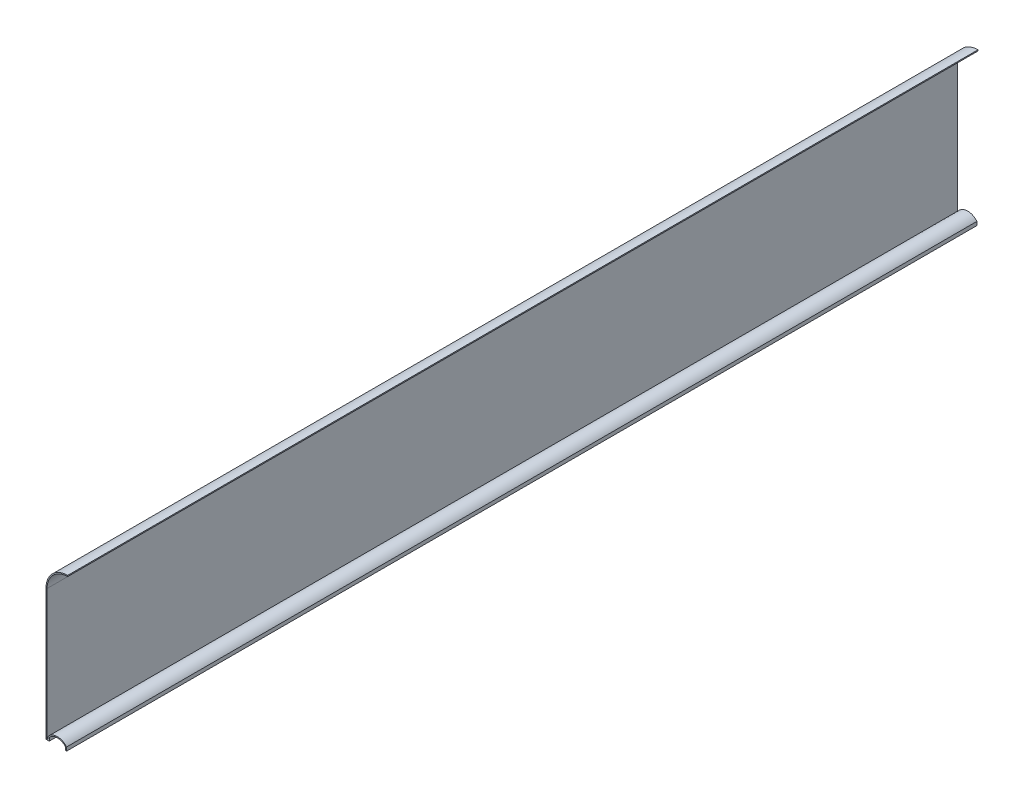
from build123d import *

# Parameters (mm, degrees)
SHEET_EXTRUDE_1_1_DEPTH = 84
THICKEN_1_T2            = 0.1


with BuildPart() as body_1:
    # Sheet Extrude 1: a surface, the sketch's curves swept straight by 84 mm
    with BuildLine(Plane.XY, mode=Mode.PRIVATE) as sheet_extrude_1_1_path:
        Line((1.799379952, 0), (1.799379952, 0.3))
        ThreePointArc((1.799379952, 0.3), (1.049689976, 0.638210804), (0.3, 0.3))
        Line((0.3, 0.3), (0.3, 0))
        Line((0.3, 0), (0, 0))
        Line((0, 0), (0, 12.1))
        ThreePointArc((0, 12.1), (0.585786438, 13.514213562), (2, 14.1))
    sheet_extrude_1_1 = Shell.extrude(sheet_extrude_1_1_path.wire(), (0 * SHEET_EXTRUDE_1_1_DEPTH, 0 * SHEET_EXTRUDE_1_1_DEPTH, 1 * SHEET_EXTRUDE_1_1_DEPTH))
    add(Solid.thicken(sheet_extrude_1_1, -THICKEN_1_T2))


solid = body_1.part
